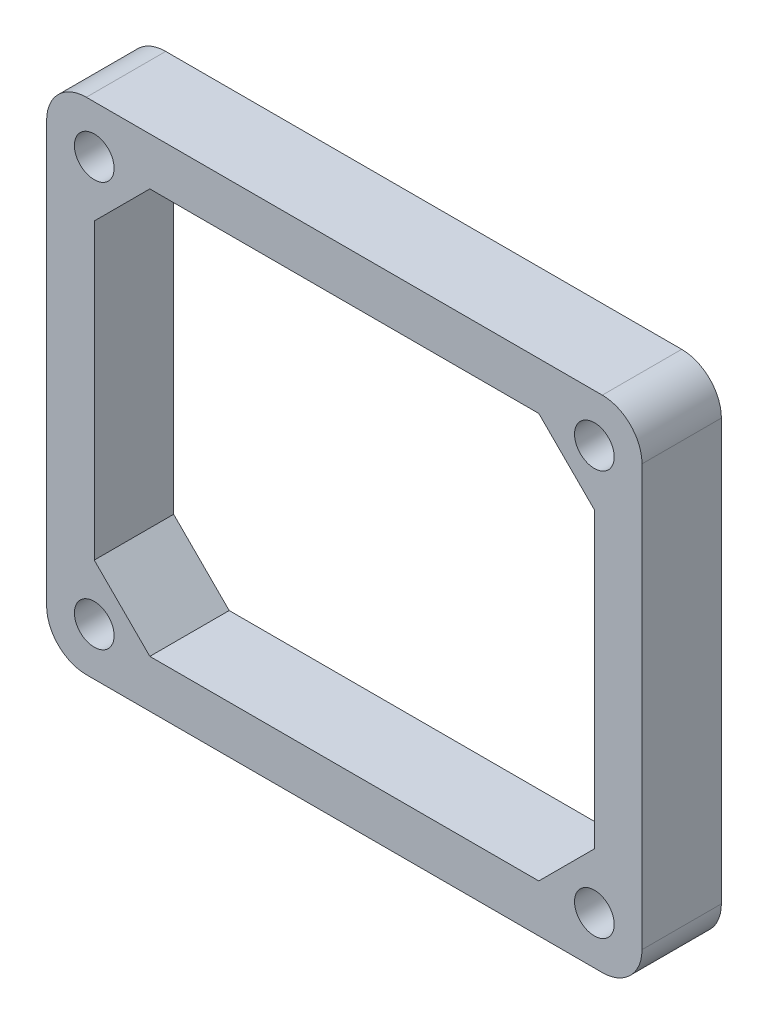
from build123d import *

# Parameters (mm, degrees)
SKETCH1_W           = 75
SKETCH1_H           = 63
SKETCH1_R           = 2.5
BOSS_EXTRUDE1_DEPTH = 10
FILLET1_R           = 5


with BuildPart() as part:
    # Sketch1 → Boss-Extrude1 (new body)
    with BuildSketch(Plane.XY):
        with Locations((-1.818499155, -14.396959459)):
            Rectangle(SKETCH1_W, SKETCH1_H)
        with Locations((-33.318499155, 11.103040541)):
            Circle(SKETCH1_R, mode=Mode.SUBTRACT)
        with Locations((29.681500845, 11.103040541)):
            Circle(SKETCH1_R, mode=Mode.SUBTRACT)
        with Locations((29.681500845, -39.896959459)):
            Circle(SKETCH1_R, mode=Mode.SUBTRACT)
        with Locations((-33.318499155, -39.896959459)):
            Circle(SKETCH1_R, mode=Mode.SUBTRACT)
        Polygon((-33.318499155, 4.103040541), (-26.318499155, 11.103040541), (22.681500845, 11.103040541), (29.681500845, 4.103040541), (29.681500845, -32.896959459), (22.681500845, -39.896959459), (-26.318499155, -39.896959459), (-33.318499155, -32.896959459), align=None, mode=Mode.SUBTRACT)
    extrude(amount=BOSS_EXTRUDE1_DEPTH)

    # Fillet1
    fillet1_edges = [part.edges().sort_by_distance(p)[0] for p in [
        (-39.318499155, 17.103040541, 5),
        (35.681500845, 17.103040541, 5),
        (35.681500845, -45.896959459, 5),
        (-39.318499155, -45.896959459, 5),
    ]]
    fillet(fillet1_edges, radius=FILLET1_R)


solid = part.part
